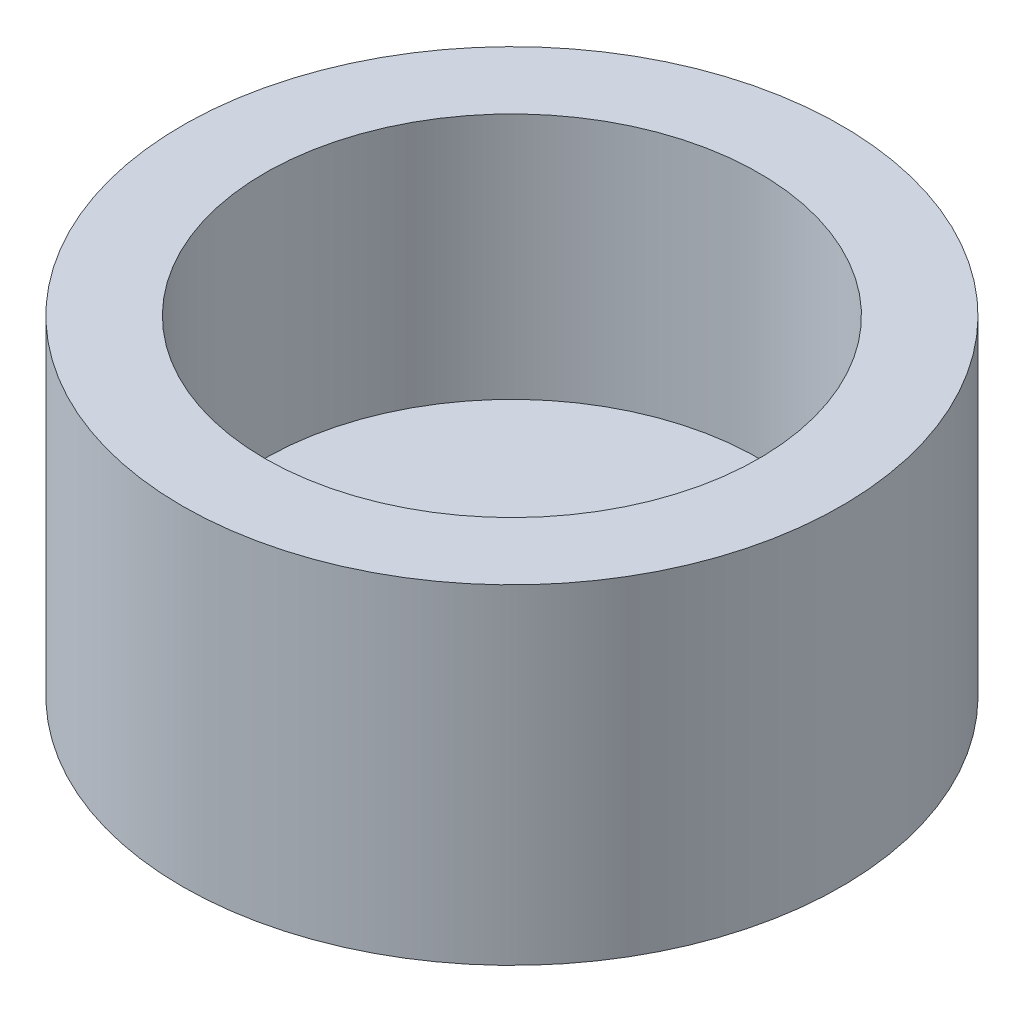
from build123d import *

# Parameters (mm, degrees)
F_1_4_CLEARANCE_HOLE1_D = 6.7564


with BuildPart() as part:
    # Sketch1 → Revolve1 (revolve)
    with BuildSketch(Plane.XY, mode=Mode.PRIVATE) as revolve1_sk:
        Polygon((0, 0), (25.4, 0), (25.4, 25.4), (19.05, 25.4), (19.05, 6.35), (0, 6.35), align=None)
    revolve(revolve1_sk.sketch.rotate(Axis((0, 6.35, 0), (0, -1, 0)), 90), axis=Axis((0, 6.35, 0), (0, -1, 0)))

    # 1/4 Clearance Hole1 (through all)
    with Locations(Plane(origin=(0, 6.35, 0), x_dir=(1, 0, 0), z_dir=(0, 1, 0))):
        with Locations((0, 0)):
            Hole(F_1_4_CLEARANCE_HOLE1_D / 2)


solid = part.part
